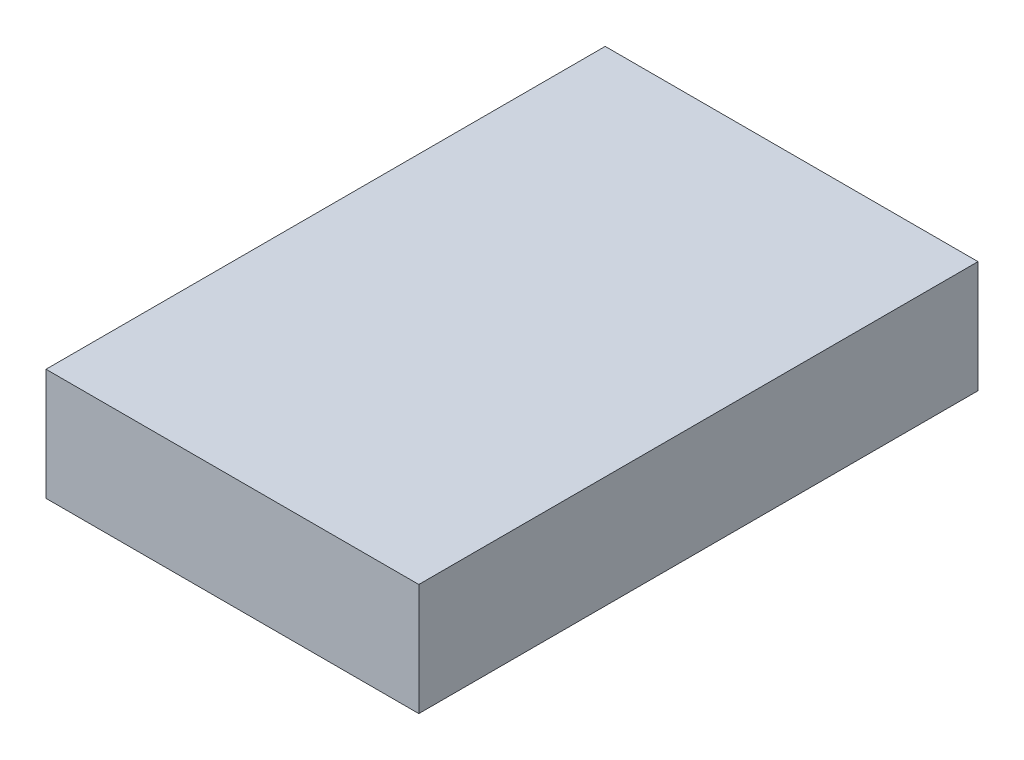
from build123d import *

# Parameters (mm, degrees)
SKETCH1_W           = 20
SKETCH1_H           = 6
BOSS_EXTRUDE1_DEPTH = 15


with BuildPart() as part:
    # Sketch1 → Boss-Extrude1 (new, symmetric)
    with BuildSketch(Plane.XY):
        Rectangle(SKETCH1_W, SKETCH1_H)
    extrude(amount=BOSS_EXTRUDE1_DEPTH, both=True)


solid = part.part
